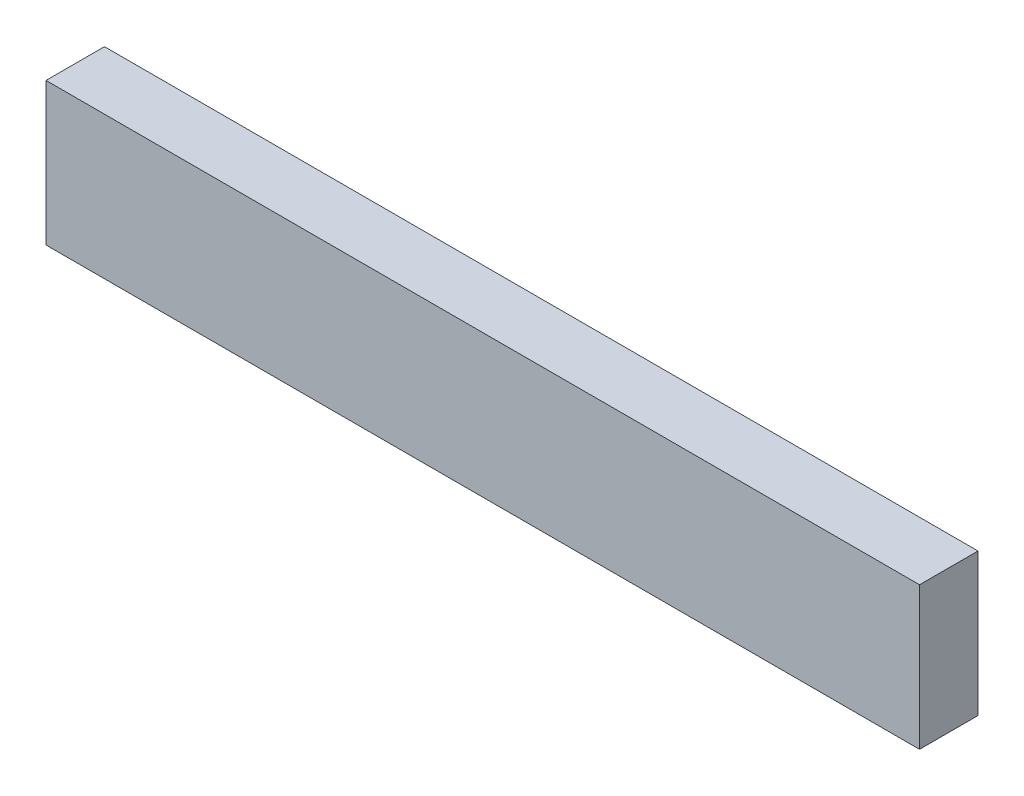
from build123d import *

# Parameters (mm, degrees)
SKETCH_1_W          = 47.8
SKETCH_1_H          = 7.8
EXTRUDE_1_DEPTH     = 3.2
SKETCH_2_R          = 2.5
CUT_EXTRUDE_1_DEPTH = 1.8


with BuildPart() as part:
    # Эскиз1 → Бобышка-Вытянуть1 (new body)
    with BuildSketch(Plane.XY):
        Rectangle(SKETCH_1_W, SKETCH_1_H)
    extrude(amount=EXTRUDE_1_DEPTH)

    # Эскиз2 → Вырез-Вытянуть1 (cut)
    with BuildSketch(Plane(origin=(0, 0, 0), x_dir=(-1, 0, 0), z_dir=(0, 0, -1))):
        with Locations((-20.491541589, 0)):
            Circle(SKETCH_2_R)
        with Locations((-12.491541589, 0)):
            Circle(SKETCH_2_R)
        with Locations((-4.491541589, 0)):
            Circle(SKETCH_2_R)
        with Locations((3.508458411, 0)):
            Circle(SKETCH_2_R)
        with Locations((11.508458411, 0)):
            Circle(SKETCH_2_R)
        with Locations((19.508458411, 0)):
            Circle(SKETCH_2_R)
    extrude(amount=-CUT_EXTRUDE_1_DEPTH, mode=Mode.SUBTRACT)


solid = part.part
